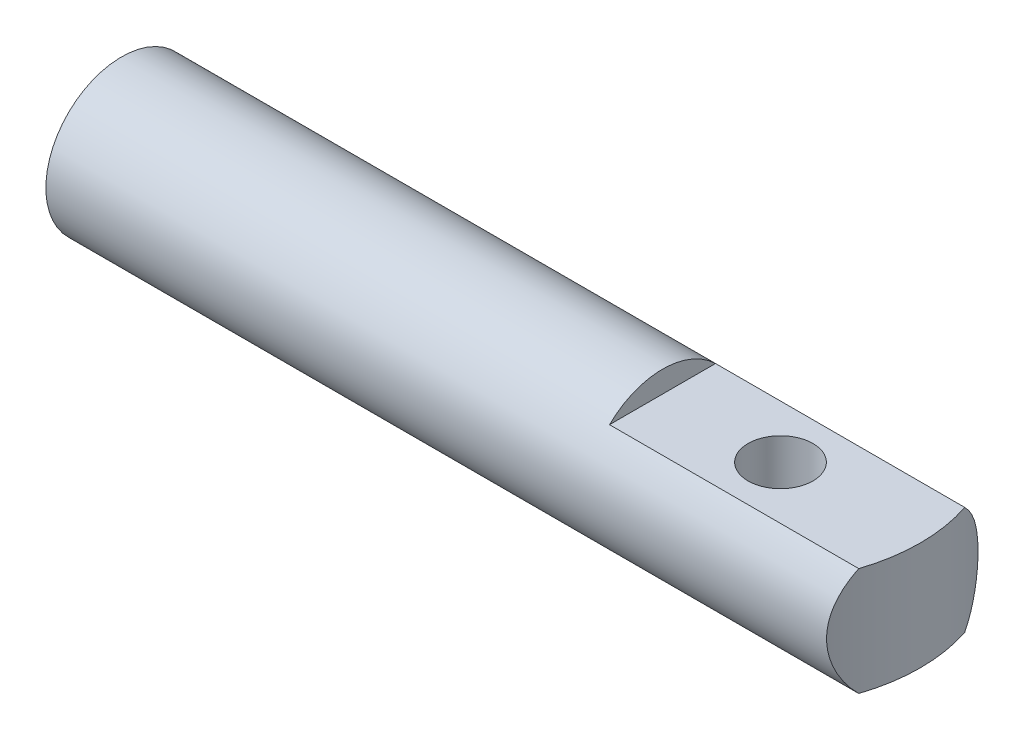
from build123d import *

# Parameters (mm, degrees)
SKETCH1_W           = 100
SKETCH1_H           = 2
BOSS_EXTRUDE1_START = -16
SKETCH2_R           = 12
BOSS_EXTRUDE1_DEPTH = 16
SKETCH3_R           = 31
BOSS_EXTRUDE2_DEPTH = 10
SKETCH4_OUTSIDE_W   = 96.516
SKETCH4_OUTSIDE_H   = 62.516
SKETCH4_OUTSIDE_R   = 14
CUT_EXTRUDE1_DEPTH  = 152.530264345
SKETCH5_R           = 6
CUT_EXTRUDE2_DEPTH  = 165.501660515
SKETCH6_R           = 12
SKETCH6_R_2         = 8
BOSS_EXTRUDE3_DEPTH = 2


with BuildPart() as part:
    # Sketch1 → Revolve1 (revolve)
    with BuildSketch(Plane(origin=(0, 0, 0), x_dir=(1, 0, 0), z_dir=(0, 1, 0))):
        with Locations((64.475, 13)):
            Rectangle(SKETCH1_W, SKETCH1_H)
    revolve(axis=Axis((134.425, 0, 0), (-1, 0, 0)))

    # Sketch2 → Boss-Extrude1 (add)
    with BuildSketch(Plane(origin=(114.475, 0, 0), x_dir=(0, 0, -1), z_dir=(1, 0, 0)).offset(BOSS_EXTRUDE1_START)):
        Circle(SKETCH2_R)
    extrude(amount=BOSS_EXTRUDE1_DEPTH)

    # Sketch3 → Boss-Extrude2 (add, symmetric)
    with BuildSketch(Plane(origin=(0, 0, 0), x_dir=(1, 0, 0), z_dir=(0, 1, 0))):
        with Locations((131.13820115, 0)):
            Circle(SKETCH3_R)
    extrude(amount=BOSS_EXTRUDE2_DEPTH, both=True)

    # Sketch4 outside → Cut-Extrude1 (cut, through all)
    with BuildSketch(Plane.ZY.offset(-14.475)):
        Rectangle(SKETCH4_OUTSIDE_W, SKETCH4_OUTSIDE_H)
        with Locations(Location((0, 0, 0), (0, 0, 180))):
            Circle(SKETCH4_OUTSIDE_R, mode=Mode.SUBTRACT)
    extrude(amount=-CUT_EXTRUDE1_DEPTH, mode=Mode.SUBTRACT)

    # Sketch5 → Cut-Extrude2 (cut, through all)
    with BuildSketch(Plane.XZ.offset(10)):
        with Locations(Location((136.284742261, 0, 0), (0, 0, 270))):
            Circle(SKETCH5_R)
    extrude(amount=-CUT_EXTRUDE2_DEPTH, mode=Mode.SUBTRACT)

    # Sketch6 → Boss-Extrude3 (add)
    with BuildSketch(Plane.ZY.offset(-14.475)):
        with Locations(Location((0, 0, 0), (0, 0, 180))):
            Circle(SKETCH6_R)
        Circle(SKETCH6_R_2, mode=Mode.SUBTRACT)
    extrude(amount=-BOSS_EXTRUDE3_DEPTH)


solid = part.part
